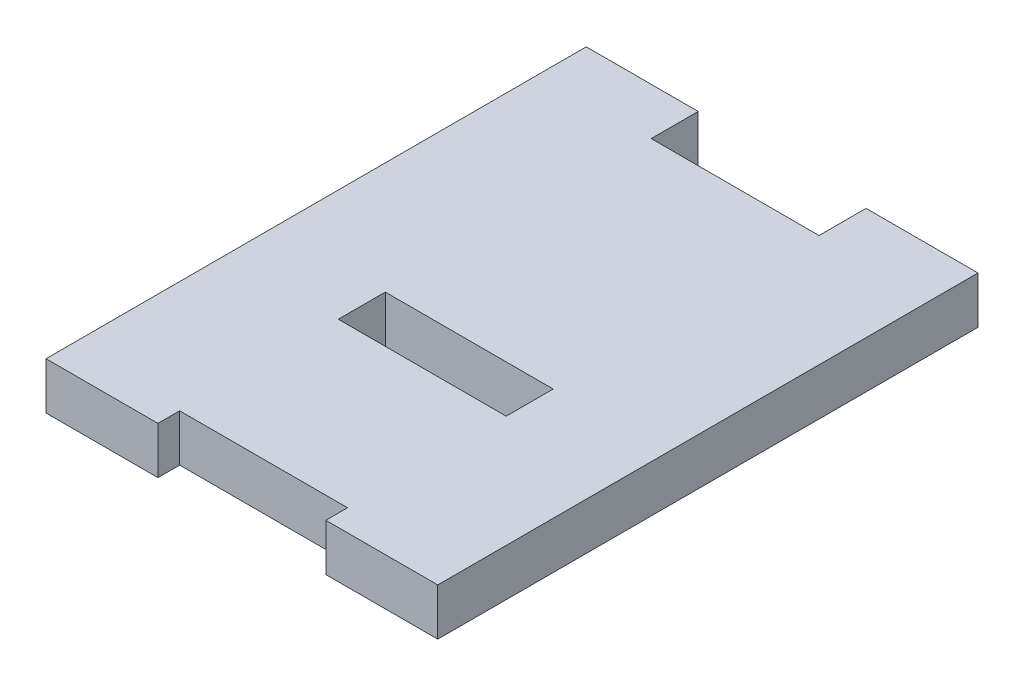
from build123d import *

# Parameters (mm, degrees)
SKETCH1_W           = 44.45
SKETCH1_H           = 61.300000082
BOSS_EXTRUDE1_DEPTH = 5.334
SKETCH2_W           = 19.05
SKETCH2_H           = 2.4638
SKETCH2_H_2         = 5.334
CUT_EXTRUDE1_DEPTH  = 76.907470423


with BuildPart() as part:
    # Sketch1 → Boss-Extrude1 (new body)
    with BuildSketch(Plane(origin=(0, 0, 0), x_dir=(1, 0, 0), z_dir=(0, 1, 0))):
        with Locations((22.225, 30.650000041)):
            Rectangle(SKETCH1_W, SKETCH1_H)
    extrude(amount=BOSS_EXTRUDE1_DEPTH)

    # Sketch2 → Cut-Extrude1 (cut, through all)
    with BuildSketch(Plane(origin=(0, 5.334, 0), x_dir=(1, 0, 0), z_dir=(0, 1, 0))):
        with Locations((22.225, 1.2319)):
            Rectangle(SKETCH2_W, SKETCH2_H)
        with Locations((22.225, 23.1308)):
            Rectangle(SKETCH2_W, SKETCH2_H_2)
        with Locations((22.225, 58.633000082)):
            Rectangle(SKETCH2_W, SKETCH2_H_2)
    extrude(amount=-CUT_EXTRUDE1_DEPTH, mode=Mode.SUBTRACT)


solid = part.part
